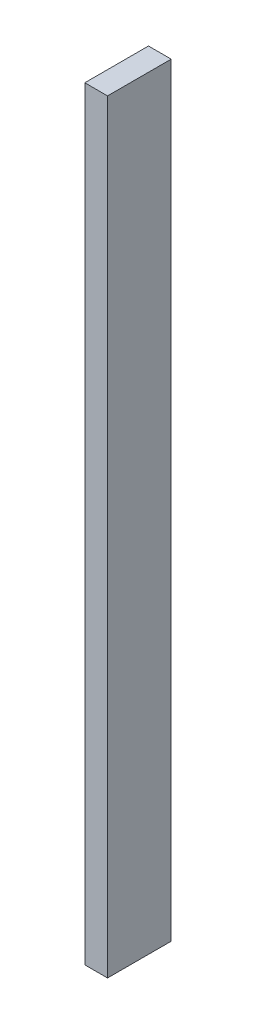
from build123d import *

# Parameters (mm, degrees)
SKETCH1_W           = 3.175
SKETCH1_H           = 8.89
BOSS_EXTRUDE1_DEPTH = 106.68


with BuildPart() as part:
    # Sketch1 → Boss-Extrude1 (new body)
    with BuildSketch(Plane(origin=(0, 0, 0), x_dir=(1, 0, 0), z_dir=(0, 1, 0))):
        with Locations((1.5875, 4.445)):
            Rectangle(SKETCH1_W, SKETCH1_H)
    extrude(amount=BOSS_EXTRUDE1_DEPTH)


solid = part.part
